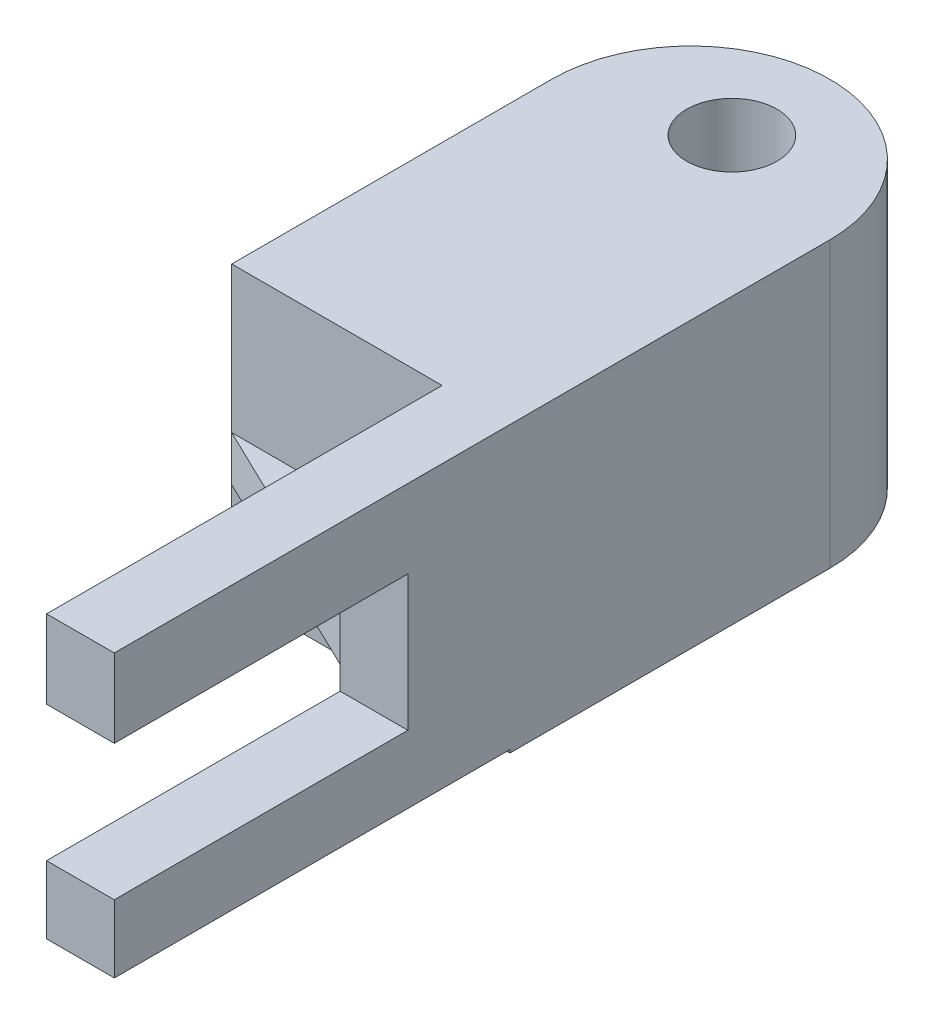
from build123d import *

# Parameters (mm, degrees)
BOSS_EXTRUDE3_DEPTH = 15
BOSS_EXTRUDE6_DEPTH = 63
SKETCH8_R           = 10
CUT_EXTRUDE1_DEPTH  = 60
BOSS_EXTRUDE8_DEPTH = 10


with BuildPart() as part:
    # Sketch4 → Boss-Extrude3 (new body)
    with BuildSketch(Plane(origin=(0, 0, 0), x_dir=(0, 0, -1), z_dir=(1, 0, 0))):
        Polygon((0, 0), (0, 62.333333333), (-87.595238095, 62.333333333), (-87.595238095, 45), (-22.595238095, 45), (-22.595238095, 15), (-87.595238095, 15), (-87.595238095, 0), align=None)
    extrude(amount=BOSS_EXTRUDE3_DEPTH)

    # Sketch7 → Boss-Extrude6 (add)
    with BuildSketch(Plane(origin=(0, 62.333333333, 0), x_dir=(1, 0, 0), z_dir=(0, 1, 0))):
        with BuildLine():
            Line((15, 0), (15, 70.864702181))
            ThreePointArc((15, 70.864702181), (-15.798204654, 101.662906835), (-46.596409308, 70.864702181))
            Line((-46.596409308, 70.864702181), (-46.596409308, 0))
            Line((-46.596409308, 0), (0, 0))
            Line((0, 0), (15, 0))
        make_face()
    extrude(amount=-BOSS_EXTRUDE6_DEPTH)

    # Sketch8 → Cut-Extrude1 (cut)
    with BuildSketch(Plane(origin=(0, 62.333333333, 0), x_dir=(1, 0, 0), z_dir=(0, 1, 0))):
        with Locations(Location((-15.914385608, 80.072094145, 0), (0, 0, 270))):
            Circle(SKETCH8_R)
    extrude(amount=-CUT_EXTRUDE1_DEPTH, mode=Mode.SUBTRACT)

    # Sketch12 → Boss-Extrude8 (add)
    with BuildSketch(Plane(origin=(0, 20, 0), x_dir=(1, 0, 0), z_dir=(0, 1, 0))):
        Polygon((-46.596409308, 0), (0, 0), (0, -22.515812616), align=None)
    extrude(amount=BOSS_EXTRUDE8_DEPTH)


solid = part.part
